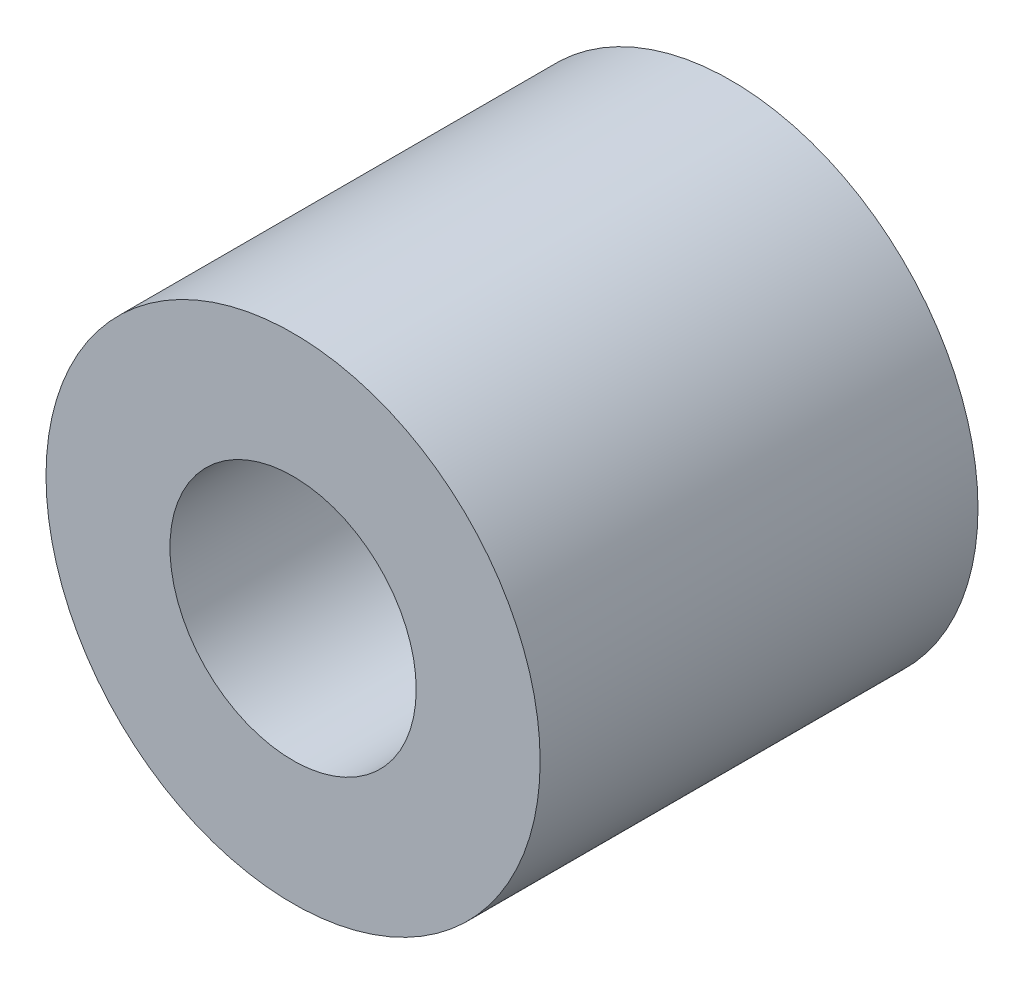
from build123d import *

# Parameters (mm, degrees)
SKETCH1_R           = 5.0165
SKETCH1_R_2         = 2.5
BOSS_EXTRUDE1_DEPTH = 4.445


with BuildPart() as part:
    # Sketch1 → Boss-Extrude1 (new, symmetric)
    with BuildSketch(Plane.XY):
        Circle(SKETCH1_R)
        Circle(SKETCH1_R_2, mode=Mode.SUBTRACT)
    extrude(amount=BOSS_EXTRUDE1_DEPTH, both=True)


solid = part.part
